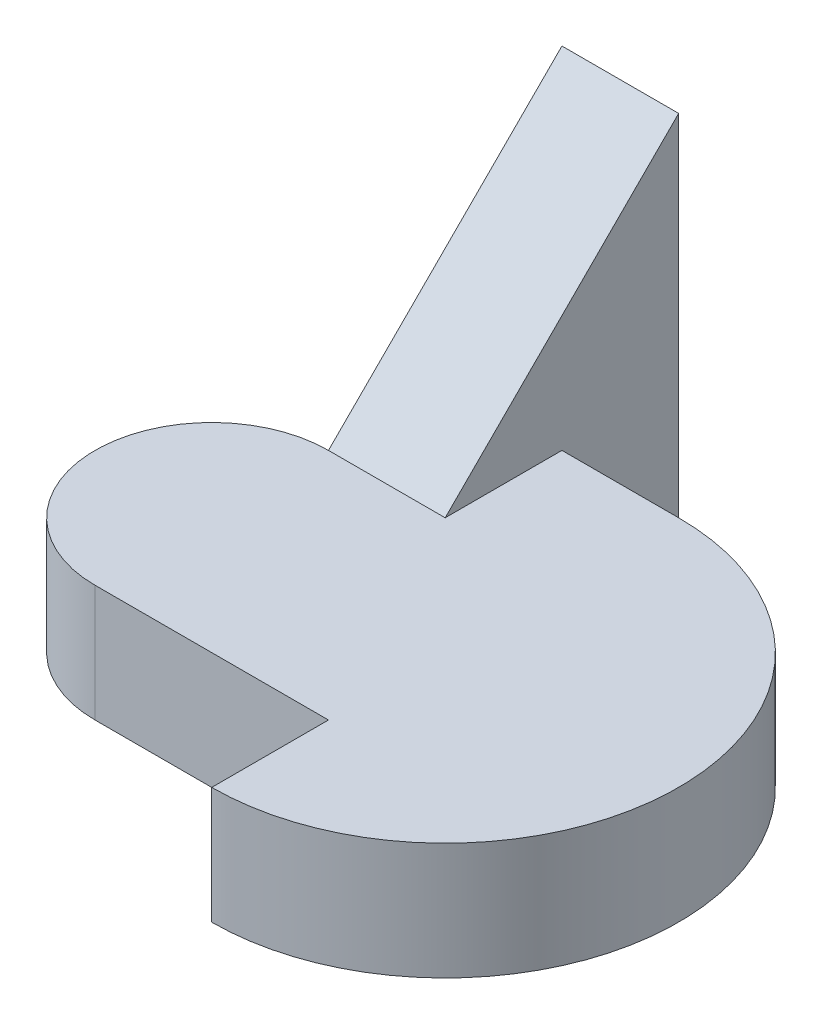
from build123d import *

# Parameters (mm, degrees)
BOSS_EXTRUDE1_DEPTH = 10
BOSS_EXTRUDE2_DEPTH = 10


with BuildPart() as part:
    # Sketch1 → Boss-Extrude1 (new body)
    with BuildSketch(Plane(origin=(0, 0, 0), x_dir=(1, 0, 0), z_dir=(0, 1, 0))):
        with BuildLine():
            Line((0, 20), (-10, 20))
            Line((-10, 20), (-10, 10))
            Line((-10, 10), (-20, 10))
            ThreePointArc((-20, 10), (-30, 0), (-20, -10))
            Line((-20, -10), (0, -10))
            Line((0, -10), (0, -20))
            ThreePointArc((0, -20), (20, 0), (0, 20))
        make_face()
    extrude(amount=BOSS_EXTRUDE1_DEPTH)

    # Sketch2 → Boss-Extrude2 (add)
    with BuildSketch(Plane.ZY.offset(10)):
        Polygon((-10, 10), (-30, 30), (-30, 0), (-10, 0), align=None)
    extrude(amount=BOSS_EXTRUDE2_DEPTH)


solid = part.part
